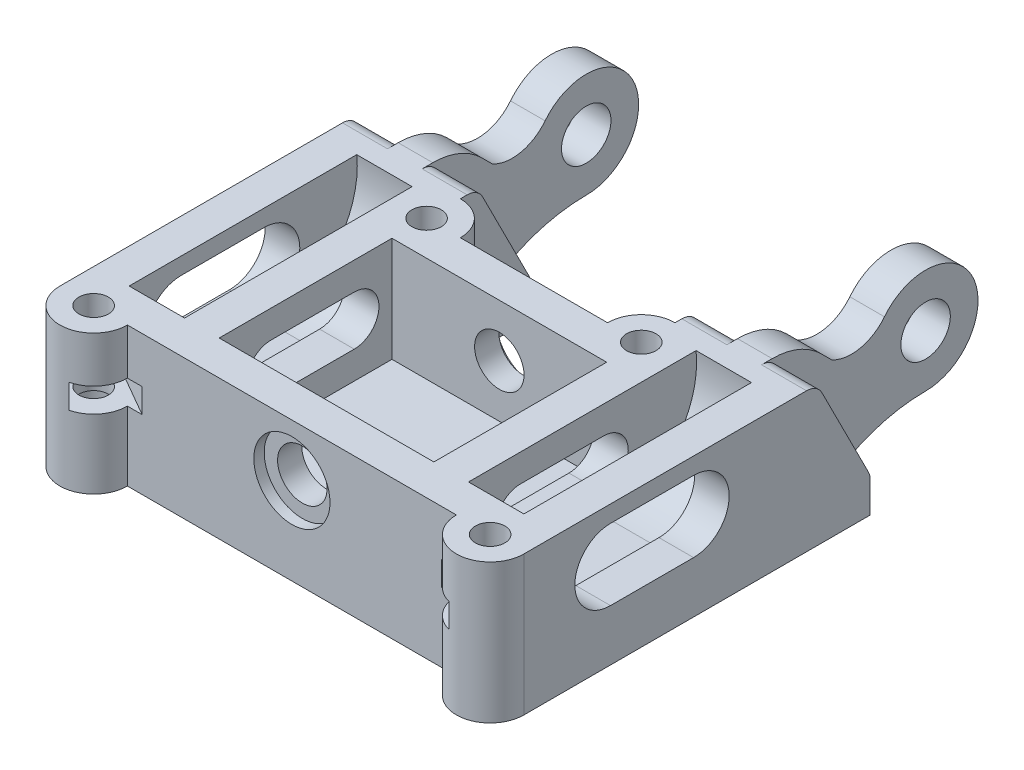
from build123d import *
from build123d.topology import SkipClean

# Parameters (mm, degrees)
SKETCH1_R               = 3.57
BOSS_EXTRUDE1_DEPTH     = 18
CUT_EXTRUDE4_DEPTH      = 4
CUT_EXTRUDE4_DEPTH_BACK = 4
CUT_EXTRUDE5_DEPTH      = 6.5
SKETCH9_W               = 50
SKETCH9_H               = 5
BOSS_EXTRUDE2_DEPTH     = 15.5
FILLET8_R               = 2.5
BOSS_EXTRUDE3_REACH     = 75.76
SKETCH13_W              = 5
SKETCH13_H              = 15.14
SKETCH16_W              = 15.5
SKETCH16_H              = 5
BOSS_EXTRUDE4_DEPTH     = 15.14
CUT_EXTRUDE8_REACH      = 77.34
CUT_EXTRUDE9_DEPTH      = 5
CUT_EXTRUDE10_DEPTH     = 1.5
CUT_EXTRUDE11_START     = -1.5
SKETCH20_R              = 5.5
CUT_EXTRUDE11_DEPTH     = 1.5
SKETCH21_W              = 31
SKETCH21_H              = 15.05
CUT_EXTRUDE12_DEPTH     = 5
BOSS_EXTRUDE11_DEPTH    = 20.14
SKETCH31_R              = 2.125
CUT_EXTRUDE16_DEPTH     = 20.14
SKETCH38_R              = 3
CUT_EXTRUDE19_DEPTH     = 8
CUT_EXTRUDE21_DEPTH     = 3.5


with BuildPart() as part:
    # Sketch1 → Boss-Extrude1 (new body)
    with BuildSketch(Plane(origin=(0, 0, 0), x_dir=(0, 0, -1), z_dir=(1, 0, 0))):
        with BuildLine():
            Line((-64.5, -12.57), (-14.5, -12.57))
            ThreePointArc((-14.5, -12.57), (-7.668930825, -8.855100607), (0, -7.57))
            ThreePointArc((0, -7.57), (6.813585795, 3.298476711), (-5.937768577, 4.695508953))
            ThreePointArc((-5.937768577, 4.695508953), (-9.447591416, 2.520990205), (-13.536399337, 3.094608482))
            Line((-13.536399337, 3.094608482), (-15.082858667, 4.641067812))
            ThreePointArc((-15.082858667, 4.641067812), (-18.327092155, 6.808795325), (-22.153926479, 7.57))
            Line((-22.153926479, 7.57), (-24.481144331, 7.57))
            Line((-24.481144331, 7.57), (-64.5, 7.57))
            Line((-64.5, 7.57), (-64.5, -12.57))
        make_face()
        Circle(SKETCH1_R, mode=Mode.SUBTRACT)
        with BuildLine():
            Line((-52, 3.57), (-40, 3.57))
            ThreePointArc((-40, 3.57), (-36.43, 0), (-40, -3.57))
            Line((-40, -3.57), (-52, -3.57))
            ThreePointArc((-52, -3.57), (-55.57, 0), (-52, 3.57))
        make_face(mode=Mode.SUBTRACT)
    extrude(amount=BOSS_EXTRUDE1_DEPTH)

    # Sketch7 → Cut-Extrude4 (cut, two sides: drawn at the far end of the back side and taken through both)
    with BuildSketch(Plane.ZY.offset(-9).offset(-CUT_EXTRUDE4_DEPTH_BACK)):
        with BuildLine():
            Line((68.683555498, -7.57), (38.854158917, -7.57))
            ThreePointArc((38.854158917, -7.57), (29.611049041, -2.529814803), (26.6391325, 7.57))
            Line((26.6391325, 7.57), (68.683555498, 7.57))
            Line((68.683555498, 7.57), (68.683555498, -7.57))
        make_face()
    extrude(amount=CUT_EXTRUDE4_DEPTH + CUT_EXTRUDE4_DEPTH_BACK, mode=Mode.SUBTRACT)

    # Sketch8 → Cut-Extrude5 (cut)
    with BuildSketch(Plane(origin=(18, 0, 0), x_dir=(0, 0, -1), z_dir=(1, 0, 0))):
        Polygon((-14.5, -12.57), (-14.5, -7.57), (-22.153926479, 7.57), (4.247659324, 15.20685859), (9.411129334, 3.26000641), (7.386239134, -6.35822204), align=None)
    cut_extrude5 = extrude(amount=-CUT_EXTRUDE5_DEPTH, mode=Mode.SUBTRACT)

    # Sketch9 → Boss-Extrude2 (add)
    with BuildSketch(Plane.ZY):
        with Locations((39.5, -10.07)):
            Rectangle(SKETCH9_W, SKETCH9_H)
    extrude(amount=BOSS_EXTRUDE2_DEPTH)

    # Mirror2: Cut-Extrude5 across plane
    add(cut_extrude5.mirror(Plane.ZY.offset(-9)), mode=Mode.SUBTRACT)

    # Fillet8
    fillet8_edges = [part.edges().sort_by_distance(p)[0] for p in [
        (3.25, 7.57, 22.153926479),
        (14.75, 7.57, 22.153926479),
        (14.75, -7.57, 14.5),
    ]]
    fillet(fillet8_edges, radius=FILLET8_R)

    # Boss-Extrude3: up to this face of the body (flat: up to its plane)
    boss_extrude3_end = Plane(part.part.faces().sort_by_distance((-15.5, -10.07, 39.5))[0])
    # Sketch13 → Boss-Extrude3 (add, up to the picked face)
    with BuildSketch(Plane(origin=(18, 0, 0), x_dir=(0, 0, -1), z_dir=(1, 0, 0)), mode=Mode.PRIVATE) as boss_extrude3_sk1:
        with Locations((-62, 0)):
            Rectangle(SKETCH13_W, SKETCH13_H)
    boss_extrude3_tool1 = split(extrude(boss_extrude3_sk1.sketch, amount=-BOSS_EXTRUDE3_REACH, mode=Mode.PRIVATE), bisect_by=boss_extrude3_end, keep=Keep.BOTH, mode=Mode.PRIVATE)
    add(boss_extrude3_tool1.solids().sort_by(Axis((18, 0, 62), (-1, 0, 0)))[0])

    # Sketch16 → Boss-Extrude4 (add)
    with BuildSketch(Plane(origin=(0, -7.57, 0), x_dir=(1, 0, 0), z_dir=(0, 1, 0))):
        with Locations((-7.75, -32.05)):
            Rectangle(SKETCH16_W, SKETCH16_H)
    extrude(amount=BOSS_EXTRUDE4_DEPTH)

    # Cut-Extrude8: up to this face of the body (flat: up to its plane)
    cut_extrude8_end = Plane(part.part.faces().sort_by_distance((-7.75, 0, 29.55))[0])
    # Sketch14 → Cut-Extrude8 (cut, up to the picked face)
    with BuildSketch(Plane.XY.offset(64.5), mode=Mode.PRIVATE) as cut_extrude8_sk1:
        with BuildLine():
            Line((-15.5, 3.57), (-15.5, -3.57))
            ThreePointArc((-15.5, -3.57), (-11.93, 0), (-15.5, 3.57))
        make_face()
    cut_extrude8_tool1 = split(extrude(cut_extrude8_sk1.sketch, amount=-CUT_EXTRUDE8_REACH, mode=Mode.PRIVATE), bisect_by=cut_extrude8_end, keep=Keep.BOTH, mode=Mode.PRIVATE)
    add(cut_extrude8_tool1.solids().sort_by(Axis((-13.984845, 0, 64.5), (0, 0, -1)))[0], mode=Mode.SUBTRACT)

    # Sketch17 → Cut-Extrude9 (cut)
    with BuildSketch(Plane(origin=(18, 0, 0), x_dir=(0, 0, -1), z_dir=(1, 0, 0))):
        with BuildLine():
            Line((-40, -5.14), (-52, -5.14))
            ThreePointArc((-52, -5.14), (-57.14, 0), (-52, 5.14))
            Line((-52, 5.14), (-40, 5.14))
            ThreePointArc((-40, 5.14), (-34.86, 0), (-40, -5.14))
        make_face()
    extrude(amount=-CUT_EXTRUDE9_DEPTH, mode=Mode.SUBTRACT)

    # Sketch19 → Cut-Extrude10 (cut)
    with BuildSketch(Plane.XY.offset(64.5)):
        with BuildLine():
            Line((-15.5, 5.5), (-15.5, -5.5))
            ThreePointArc((-15.5, -5.5), (-10, 0), (-15.5, 5.5))
        make_face()
    extrude(amount=-CUT_EXTRUDE10_DEPTH, mode=Mode.SUBTRACT)

    # Sketch20 → Cut-Extrude11 (cut)
    with BuildSketch(Plane(origin=(0, 0, 29.55), x_dir=(-1, 0, 0), z_dir=(0, 0, -1)).offset(CUT_EXTRUDE11_START)):
        with Locations((15.5, 0)):
            Circle(SKETCH20_R)
    extrude(amount=CUT_EXTRUDE11_DEPTH, mode=Mode.SUBTRACT)

    # Mirror3: part across plane


with BuildPart() as part_1:
    with SkipClean():  # the faces are left unmerged after this step: merging them gives an invalid solid
        add(part.part)
        add(part.part.mirror(Plane(origin=(-15.5, 0, 0), x_dir=(0, 0, 1), z_dir=(1, 0, 0))))

    # Sketch21 → Cut-Extrude12 (cut)
    with SkipClean():  # the faces are left unmerged after this step: merging them gives an invalid solid
        with BuildSketch(Plane(origin=(0, -7.57, 0), x_dir=(1, 0, 0), z_dir=(0, 1, 0))):
            with Locations((-15.5, -22.025)):
                Rectangle(SKETCH21_W, SKETCH21_H)
        extrude(amount=-CUT_EXTRUDE12_DEPTH, mode=Mode.SUBTRACT)

    # Sketch30 → Boss-Extrude11 (add)
    with SkipClean():  # the faces are left unmerged after this step: merging them gives an invalid solid
        with BuildSketch(Plane(origin=(0, 7.57, 0), x_dir=(1, 0, 0), z_dir=(0, 1, 0))):
            with BuildLine():
                Line((0, -24.675), (0, -27.425))
                ThreePointArc((0, -27.425), (-1.50260191, -28.04739809), (-2.125, -29.55))
                Line((-2.125, -29.55), (-4.875, -29.55))
                ThreePointArc((-4.875, -29.55), (-3.447145558, -26.102854442), (0, -24.675))
            make_face()
            with BuildLine():
                Line((11, -64.5), (8.25, -64.5))
                ThreePointArc((8.25, -64.5), (13.125, -69.375), (18, -64.5))
                Line((18, -64.5), (15.25, -64.5))
                ThreePointArc((15.25, -64.5), (13.125, -66.625), (11, -64.5))
            make_face()
            with BuildLine():
                Line((-42, -64.5), (-39.25, -64.5))
                ThreePointArc((-39.25, -64.5), (-44.125, -69.375), (-49, -64.5))
                Line((-49, -64.5), (-46.25, -64.5))
                ThreePointArc((-46.25, -64.5), (-44.125, -66.625), (-42, -64.5))
            make_face()
        boss_extrude11 = extrude(amount=-BOSS_EXTRUDE11_DEPTH)

    # Sketch31 → Cut-Extrude16 (cut)
    with SkipClean():  # the faces are left unmerged after this step: merging them gives an invalid solid
        with BuildSketch(Plane(origin=(0, 7.57, 0), x_dir=(1, 0, 0), z_dir=(0, 1, 0))):
            with Locations(Location((0, -29.55, 0), (0, 0, 270))):
                Circle(SKETCH31_R)
            with Locations(Location((13.125, -64.5, 0), (0, 0, 270))):
                Circle(SKETCH31_R)
            with Locations(Location((-44.125, -64.5, 0), (0, 0, 270))):
                Circle(SKETCH31_R)
        cut_extrude16 = extrude(amount=-CUT_EXTRUDE16_DEPTH, mode=Mode.SUBTRACT)

    # Mirror4: Boss-Extrude11, Cut-Extrude16 across plane
    with SkipClean():  # the faces are left unmerged after this step: merging them gives an invalid solid
        add(boss_extrude11.mirror(Plane(origin=(-15.5, 0, 0), x_dir=(0, 0, 1), z_dir=(1, 0, 0))))
        add(cut_extrude16.mirror(Plane(origin=(-15.5, 0, 0), x_dir=(0, 0, 1), z_dir=(1, 0, 0))), mode=Mode.SUBTRACT)

    # Sketch38 → Cut-Extrude19 (cut)
    with SkipClean():  # the faces are left unmerged after this step: merging them gives an invalid solid
        with BuildSketch(Plane.XZ.offset(12.57)):
            with Locations(Location((-31, 29.55, 0), (0, 0, 270))):
                Circle(SKETCH38_R)
            with Locations(Location((0, 29.55, 0), (0, 0, 270))):
                Circle(SKETCH38_R)
            with Locations(Location((13.125, 64.5, 0), (0, 0, 270))):
                Circle(SKETCH38_R)
            with Locations(Location((-44.125, 64.5, 0), (0, 0, 270))):
                Circle(SKETCH38_R)
        extrude(amount=-CUT_EXTRUDE19_DEPTH, mode=Mode.SUBTRACT)

    # Sketch32 → Cut-Extrude21 (cut)
    with SkipClean():  # the faces are left unmerged after this step: merging them gives an invalid solid
        with BuildSketch(Plane.XZ.offset(2.57)):
            Polygon((-26.760465998, 23.060852018), (-23.260465998, 29.123029845), (-31, 33.591451884), (-34.5, 31.570725942), (-34.5, 27.529274058), align=None)
            Polygon((-39.616633693, 71.144358385), (-47.625, 66.520725942), (-47.625, 62.479274058), (-44.125, 60.458548116), (-36.116633693, 65.082180559), align=None)
            Polygon((4.550932626, 65.408788222), (13.125, 60.458548116), (16.625, 62.479274058), (16.625, 66.520725942), (8.050932626, 71.470966048), align=None)
            Polygon((0, 33.591451884), (-8.931882595, 28.434627064), (-5.431882595, 22.372449237), (3.5, 27.529274058), (3.5, 31.570725942), align=None)
        extrude(amount=-CUT_EXTRUDE21_DEPTH, mode=Mode.SUBTRACT)


solid = part_1.part
